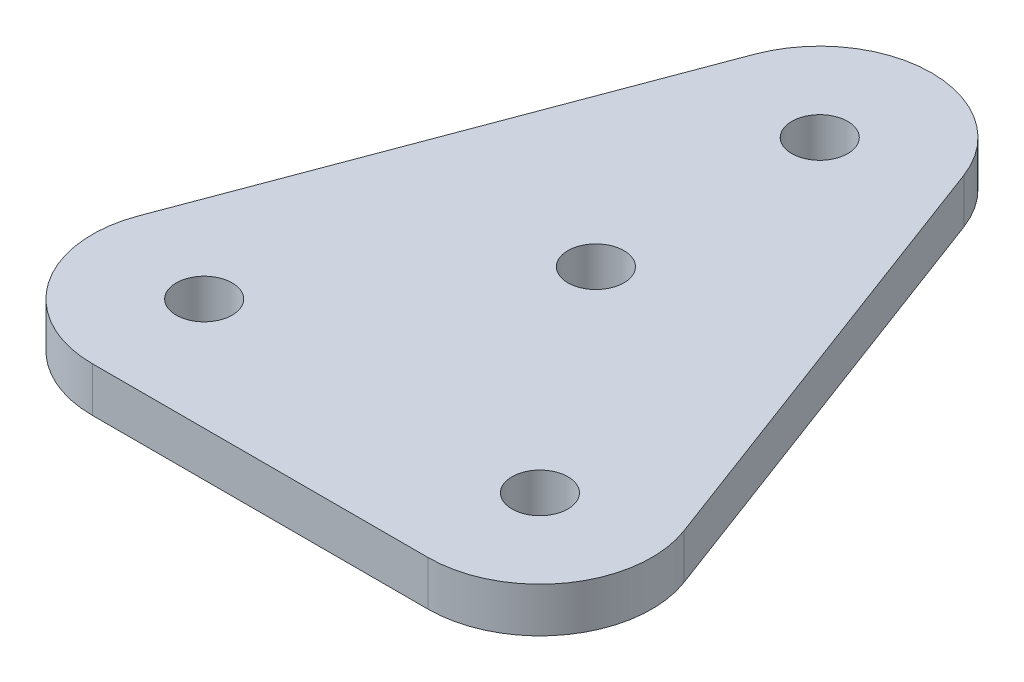
from build123d import *

# Parameters (mm, degrees)
SKETCH1_R           = 2.5
BOSS_EXTRUDE1_DEPTH = 4


with BuildPart() as part:
    # Sketch1 → Boss-Extrude1 (new body)
    with BuildSketch(Plane(origin=(0, 0, 0), x_dir=(1, 0, 0), z_dir=(0, 1, 0))):
        with BuildLine():
            Line((-9.363291776, 43.511234416), (-24.363291776, 3.511234416))
            ThreePointArc((-24.363291776, 3.511234416), (-23.219256176, -5.695948378), (-15, -10))
            Line((-15, -10), (15, -10))
            ThreePointArc((15, -10), (23.219256176, -5.695948378), (24.363291776, 3.511234416))
            Line((24.363291776, 3.511234416), (9.363291776, 43.511234416))
            ThreePointArc((9.363291776, 43.511234416), (0, 50), (-9.363291776, 43.511234416))
        make_face()
        with Locations(Location((15, 0, 0), (0, 0, 270))):
            Circle(SKETCH1_R, mode=Mode.SUBTRACT)
        with Locations(Location((-15, 0, 0), (0, 0, 90))):
            Circle(SKETCH1_R, mode=Mode.SUBTRACT)
        with Locations(Location((0, 20, 0), (0, 0, 270))):
            Circle(SKETCH1_R, mode=Mode.SUBTRACT)
        with Locations(Location((0, 40, 0), (0, 0, 270))):
            Circle(SKETCH1_R, mode=Mode.SUBTRACT)
    extrude(amount=BOSS_EXTRUDE1_DEPTH)


solid = part.part
